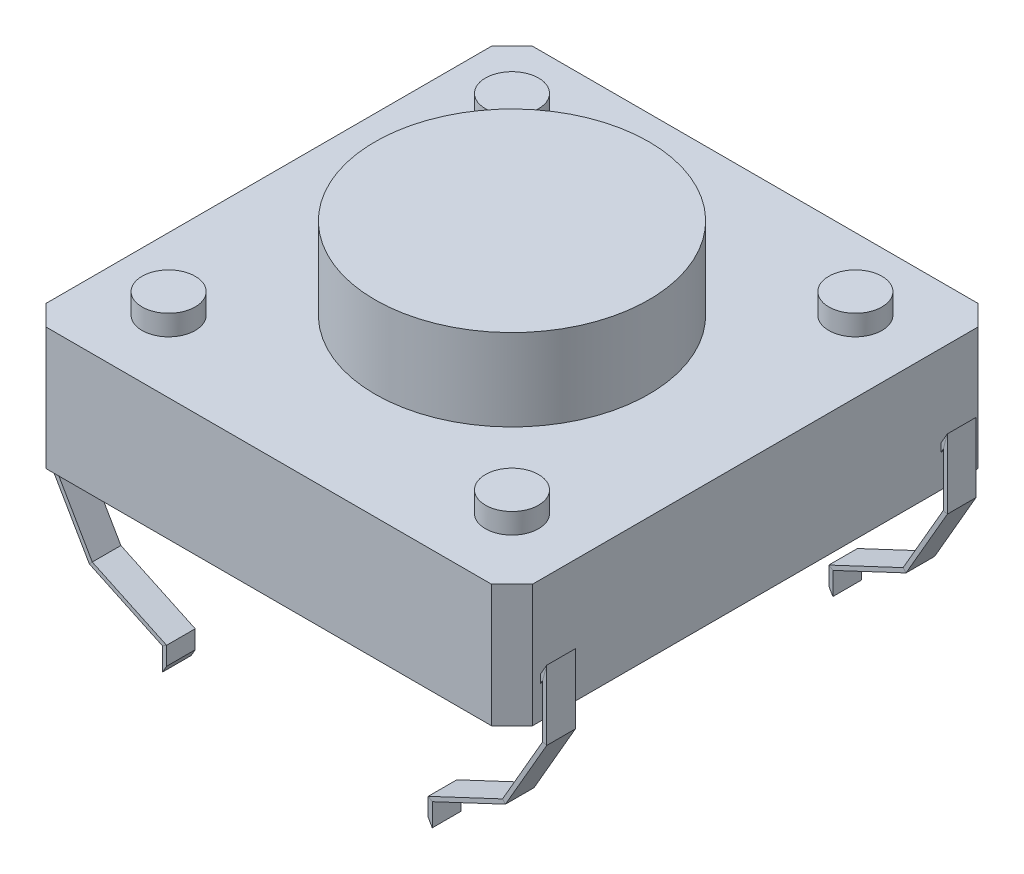
from build123d import *

# Parameters (mm, degrees)
SKETCH1_W               = 11.9
SKETCH1_H               = 11.9
BOSS_EXTRUDE1_DEPTH     = 3
CHAMFER1_SIZE           = 0.5
SKETCH3_R               = 3.35
BOSS_EXTRUDE2_DEPTH     = 2
SKETCH4_R               = 0.65
BOSS_EXTRUDE6_DEPTH     = 0.5
SKETCH6_W               = 0.7
SKETCH6_H               = 0.2
MIRROR2_COPY_1_SKETCH_W = 0.7
MIRROR2_COPY_1_SKETCH_H = 0.2


with BuildPart() as part:
    # Sketch1 → Boss-Extrude1 (new body)
    with BuildSketch(Plane(origin=(0, 0, 0), x_dir=(1, 0, 0), z_dir=(0, 1, 0))):
        Rectangle(SKETCH1_W, SKETCH1_H)
    extrude(amount=BOSS_EXTRUDE1_DEPTH)

    # Chamfer1
    chamfer1_edges = [part.edges().sort_by_distance(p)[0] for p in [
        (5.95, 1.5, 5.95),
        (-5.95, 1.5, 5.95),
        (-5.95, 1.5, -5.95),
        (5.95, 1.5, -5.95),
    ]]
    chamfer(chamfer1_edges, length=CHAMFER1_SIZE)

    # Sketch3 → Boss-Extrude2 (add)
    with BuildSketch(Plane(origin=(0, 3, 0), x_dir=(1, 0, 0), z_dir=(0, 1, 0))):
        with Locations(Location((0, 0, 0), (0, 0, 90))):
            Circle(SKETCH3_R)
    extrude(amount=BOSS_EXTRUDE2_DEPTH)

    # Sketch4 → Boss-Extrude6 (add)
    with BuildSketch(Plane(origin=(0, 3, 0), x_dir=(1, 0, 0), z_dir=(0, 1, 0))):
        with Locations(Location((4.2, 4.2, 0), (0, 0, 90))):
            Circle(SKETCH4_R)
        with Locations(Location((4.2, -4.2, 0), (0, 0, 90))):
            Circle(SKETCH4_R)
        with Locations(Location((-4.2, 4.2, 0), (0, 0, 90))):
            Circle(SKETCH4_R)
        with Locations(Location((-4.2, -4.2, 0), (0, 0, 90))):
            Circle(SKETCH4_R)
    extrude(amount=BOSS_EXTRUDE6_DEPTH)

    # Sweep1: sweep along a path in Sketch7
    with BuildLine(Plane.XY) as sweep1_path:
        Line((-5.95, 0.9), (-6.05, 1.073205081))
        Line((-6.05, 1.073205081), (-6.05, -0.426794919))
        Line((-6.05, -0.426794919), (-5.053614445, -2.152585325))
        Line((-5.053614445, -2.152585325), (-3.25, -3))
        Line((-3.25, -3), (-3.25, -3.5))
    # Sketch6 → Sweep1 (sweep)
    with BuildSketch(Plane.ZY.offset(5.95)):
        with Locations((-4.9, 0.9)):
            Rectangle(SKETCH6_W, SKETCH6_H)
    sweep1 = sweep(path=sweep1_path.line, transition=Transition.RIGHT)

    # Mirror1: Sweep1 across plane
    add(sweep1.mirror(Plane.XY))

    # Mirror2: Sweep1 across plane
    add(sweep1.mirror(Plane(origin=(0, 0, 0), x_dir=(0, 0, 1), z_dir=(1, 0, 0))))

    # Mirror2 copy 1: sweep along a path in Mirror2 copy 1 path
    with BuildLine(Plane(origin=(0, 0, 0), x_dir=(-1, 0, 0), z_dir=(0, 0, -1))) as mirror2_copy_1_path:
        Line((-5.95, 0.9), (-6.05, 1.073205081))
        Line((-6.05, 1.073205081), (-6.05, -0.426794919))
        Line((-6.05, -0.426794919), (-5.053614445, -2.152585325))
        Line((-5.053614445, -2.152585325), (-3.25, -3))
        Line((-3.25, -3), (-3.25, -3.5))
    # Mirror2 copy 1 sketch → Mirror2 copy 1 (sweep)
    with BuildSketch(Plane(origin=(5.95, 0, 0), x_dir=(0, 0, -1), z_dir=(1, 0, 0))):
        with Locations((-4.9, 0.9)):
            Rectangle(MIRROR2_COPY_1_SKETCH_W, MIRROR2_COPY_1_SKETCH_H)
    sweep(path=mirror2_copy_1_path.line, transition=Transition.RIGHT)


solid = part.part
